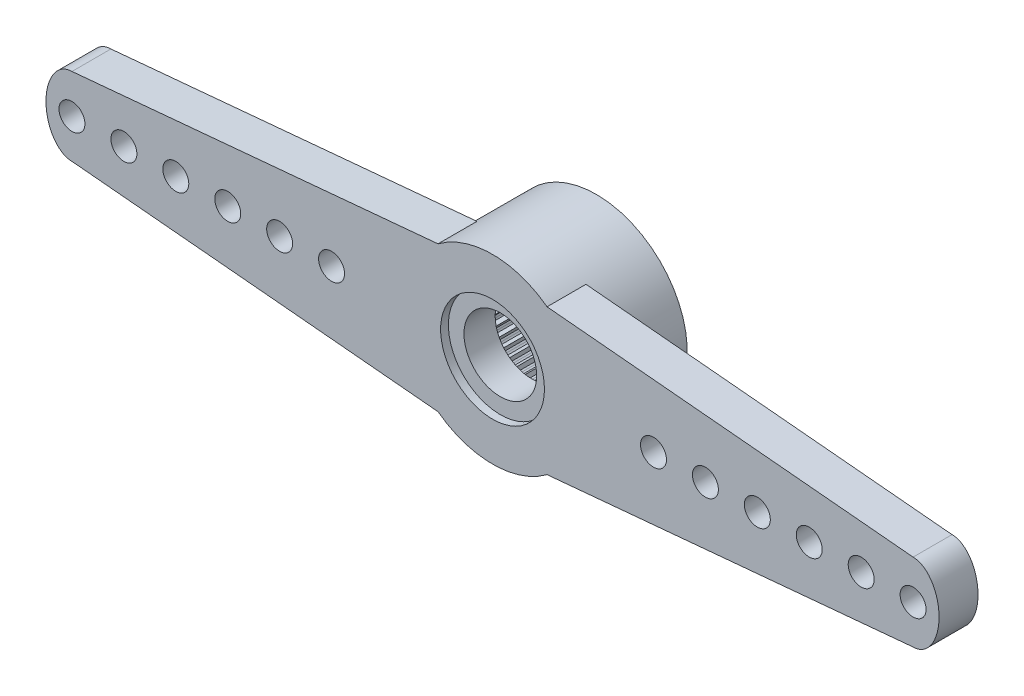
from build123d import *
from build123d.topology import SkipClean

# Parameters (mm, degrees)
CROQUIS1_R              = 0.5
SALIENTE_EXTRUIR1_DEPTH = 1.5
SALIENTE_EXTRUIR2_START = 2.5
CROQUIS3_R              = 3.5
CROQUIS3_R_2            = 2.25
SALIENTE_EXTRUIR2_DEPTH = 2.5
CROQUIS4_R              = 1.4
CORTAR_EXTRUIR1_DEPTH   = 18.729636323
CROQUIS5_R              = 2
CORTAR_EXTRUIR2_DEPTH   = 0.3
CORTAR_EXTRUIR4_DEPTH   = 2


with BuildPart() as part:
    # Croquis1 → Saliente-Extruir1 (new body)
    with BuildSketch(Plane.XY):
        with BuildLine():
            Line((-2.1, 2.8), (-16.2, 1.5))
            add(Edge.make_bspline(
                [(-16.2, 1.5), (-17.2, 1.5), (-17.2, 0), (-17.2, -1.5), (-16.2, -1.5)],
                knots=[3.141592654, 3.141592654, 3.141592654, 4.71238898, 4.71238898, 6.283185307, 6.283185307, 6.283185307], degree=2, weights=[1, 0.707106781, 1, 0.707106781, 1]))
            Line((-16.2, -1.5), (-2.1, -2.8))
            ThreePointArc((-2.1, -2.8), (0, -3.5), (2.1, -2.8))
            Line((2.1, -2.8), (16.2, -1.5))
            add(Edge.make_bspline(
                [(16.2, -1.5), (17.2, -1.5), (17.2, 0), (17.2, 1.5), (16.2, 1.5)],
                knots=[0, 0, 0, 1.570796327, 1.570796327, 3.141592654, 3.141592654, 3.141592654], degree=2, weights=[1, 0.707106781, 1, 0.707106781, 1]))
            Line((16.2, 1.5), (2.1, 2.8))
            ThreePointArc((2.1, 2.8), (0, 3.5), (-2.1, 2.8))
        make_face()
        with Locations((-16.2, 0)):
            Circle(CROQUIS1_R, mode=Mode.SUBTRACT)
        with Locations((-14.2, 0)):
            Circle(CROQUIS1_R, mode=Mode.SUBTRACT)
        with Locations((-12.2, 0)):
            Circle(CROQUIS1_R, mode=Mode.SUBTRACT)
        with Locations((-10.2, 0)):
            Circle(CROQUIS1_R, mode=Mode.SUBTRACT)
        with Locations((-8.2, 0)):
            Circle(CROQUIS1_R, mode=Mode.SUBTRACT)
        with Locations((-6.2, 0)):
            Circle(CROQUIS1_R, mode=Mode.SUBTRACT)
        with Locations(Location((6.2, 0, 0), (0, 0, 180))):
            Circle(CROQUIS1_R, mode=Mode.SUBTRACT)
        with Locations(Location((8.2, 0, 0), (0, 0, 180))):
            Circle(CROQUIS1_R, mode=Mode.SUBTRACT)
        with Locations(Location((10.2, 0, 0), (0, 0, 180))):
            Circle(CROQUIS1_R, mode=Mode.SUBTRACT)
        with Locations(Location((12.2, 0, 0), (0, 0, 180))):
            Circle(CROQUIS1_R, mode=Mode.SUBTRACT)
        with Locations(Location((14.2, 0, 0), (0, 0, 180))):
            Circle(CROQUIS1_R, mode=Mode.SUBTRACT)
        with Locations(Location((16.2, 0, 0), (0, 0, 180))):
            Circle(CROQUIS1_R, mode=Mode.SUBTRACT)
    extrude(amount=SALIENTE_EXTRUIR1_DEPTH)

    # Croquis3 → Saliente-Extruir2 (add)
    with SkipClean():  # the faces are left unmerged after this step: merging them gives an invalid solid
        with BuildSketch(Plane(origin=(0, 0, 0), x_dir=(-1, 0, 0), z_dir=(0, 0, -1)).offset(SALIENTE_EXTRUIR2_START)):
            Circle(CROQUIS3_R)
            Circle(CROQUIS3_R_2, mode=Mode.SUBTRACT)
        extrude(amount=-SALIENTE_EXTRUIR2_DEPTH)

    # Croquis4 → Cortar-Extruir1 (cut, through all)
    with SkipClean():  # the faces are left unmerged after this step: merging them gives an invalid solid
        with BuildSketch(Plane(origin=(0, 0, 0), x_dir=(-1, 0, 0), z_dir=(0, 0, -1))):
            Circle(CROQUIS4_R)
        extrude(amount=-CORTAR_EXTRUIR1_DEPTH, mode=Mode.SUBTRACT)

    # Croquis5 → Cortar-Extruir2 (cut)
    with SkipClean():  # the faces are left unmerged after this step: merging them gives an invalid solid
        with BuildSketch(Plane.XY.offset(1.5)):
            Circle(CROQUIS5_R)
        extrude(amount=-CORTAR_EXTRUIR2_DEPTH, mode=Mode.SUBTRACT)

    # Croquis6 → Cortar-Extruir4 (cut)
    with SkipClean():  # the faces are left unmerged after this step: merging them gives an invalid solid
        with BuildSketch(Plane(origin=(0, 0, -2.5), x_dir=(-1, 0, 0), z_dir=(0, 0, -1))):
            Polygon((0, -2.25), (0.10043817, -2.397897449), (0.167368384, -2.394157017), (0.234167805, -2.388546162), (0.31304517, -2.228109749), (0.433089229, -2.360589579), (0.498847515, -2.347570664), (0.564215969, -2.33271773), (0.619997273, -2.162865066), (0.757310699, -2.277348707), (0.820617148, -2.255304706), (0.883282311, -2.23149879), (0.914881833, -2.055535863), (1.066791978, -2.149795022), (1.126414401, -2.119154997), (1.185156568, -2.086859453), (1.191959259, -1.908211182), (1.355509365, -1.980411211), (1.410287279, -1.941771536), (1.4639631, -1.90161496), (1.445836554, -1.723758531), (1.617843304, -1.772494138), (1.666710519, -1.72660689), (1.714275256, -1.679370884), (1.671572286, -1.505768069), (1.848687763, -1.530090672), (1.890693135, -1.477848993), (1.931220994, -1.424452954), (1.864772764, -1.258482734), (2.043549617, -1.257918921), (2.07787556, -1.200339636), (2.110577712, -1.141822856), (2.021677561, -0.986715653), (2.198636103, -0.961276398), (2.2246145, -0.899480223), (2.248854435, -0.836981664), (2.139232704, -0.695756463), (2.310928638, -0.645936912), (2.32805385, -0.581126639), (2.343359765, -0.515862765), (2.215150116, -0.391268354), (2.378241576, -0.318038189), (2.38618028, -0.251475276), (2.392254263, -0.184716373), (2.247952151, -0.079177841), (2.399264746, 0.016037597), (2.397862424, 0.083057578), (2.394586253, 0.150012123), (2.237000354, 0.234440589), (2.373588958, 0.349788041), (2.362872904, 0.415960623), (2.350310345, 0.481807615), (2.18250789, 0.543482711), (2.30171396, 0.676717069), (2.281892751, 0.740754277), (2.260288319, 0.804212081), (2.085535392, 0.841933371), (2.185038718, 0.990461379), (2.156498151, 1.051116803), (2.126272353, 1.110950284), (1.94797032, 1.123983566), (2.025834183, 1.284914297), (1.989129768, 1.341007347), (1.950870913, 1.396051915), (1.772490222, 1.384143511), (1.82719909, 1.55434463), (1.783045236, 1.604783519), (1.737497991, 1.653967793), (1.562510617, 1.617349487), (1.592999645, 1.793508224), (1.542255757, 1.837311216), (1.490306646, 1.879677881), (1.322118521, 1.819062407), (1.327794274, 1.997750031), (1.271448023, 2.034064551), (1.214108178, 2.068788988), (1.055992892, 1.985356156), (1.036744898, 2.163094717), (0.975893001, 2.191213944), (0.914278475, 2.217620281), (0.769313562, 2.112994017), (0.725516462, 2.286324036), (0.661343331, 2.305700661), (0.596653382, 2.323274929), (0.467660419, 2.199491664), (0.400166673, 2.365039469), (0.333921365, 2.375296349), (0.267415109, 2.383696484), (0.156904797, 2.243165519), (0.067028095, 2.397708909), (0, 2.398646405), (-0.067028095, 2.397708909), (-0.156904797, 2.243165519), (-0.267415109, 2.383696484), (-0.333921365, 2.375296349), (-0.400166673, 2.365039469), (-0.467660419, 2.199491664), (-0.596653382, 2.323274929), (-0.661343331, 2.305700661), (-0.725516462, 2.286324036), (-0.769313562, 2.112994017), (-0.914278475, 2.217620281), (-0.975893001, 2.191213944), (-1.036744898, 2.163094717), (-1.055992892, 1.985356156), (-1.214108178, 2.068788988), (-1.271448023, 2.034064551), (-1.327794274, 1.997750031), (-1.322118521, 1.819062407), (-1.490306646, 1.879677881), (-1.542255757, 1.837311216), (-1.592999645, 1.793508224), (-1.562510617, 1.617349487), (-1.737497991, 1.653967793), (-1.783045236, 1.604783519), (-1.82719909, 1.55434463), (-1.772490222, 1.384143511), (-1.950870913, 1.396051915), (-1.989129768, 1.341007347), (-2.025834183, 1.284914297), (-1.94797032, 1.123983566), (-2.126272353, 1.110950284), (-2.156498151, 1.051116803), (-2.185038718, 0.990461379), (-2.085535392, 0.841933371), (-2.260288319, 0.804212081), (-2.281892751, 0.740754277), (-2.30171396, 0.676717069), (-2.18250789, 0.543482711), (-2.350310345, 0.481807615), (-2.362872904, 0.415960623), (-2.373588958, 0.349788041), (-2.237000354, 0.234440589), (-2.394586253, 0.150012123), (-2.397862424, 0.083057578), (-2.399264746, 0.016037597), (-2.247952151, -0.079177841), (-2.392254263, -0.184716373), (-2.38618028, -0.251475276), (-2.378241576, -0.318038189), (-2.215150116, -0.391268354), (-2.343359765, -0.515862765), (-2.32805385, -0.581126639), (-2.310928638, -0.645936912), (-2.139232704, -0.695756463), (-2.248854435, -0.836981664), (-2.2246145, -0.899480223), (-2.198636103, -0.961276398), (-2.021677561, -0.986715653), (-2.110577712, -1.141822856), (-2.07787556, -1.200339636), (-2.043549617, -1.257918921), (-1.864772764, -1.258482734), (-1.931220994, -1.424452954), (-1.890693135, -1.477848993), (-1.848687763, -1.530090672), (-1.671572286, -1.505768069), (-1.714275256, -1.679370884), (-1.666710519, -1.72660689), (-1.617843304, -1.772494138), (-1.445836554, -1.723758531), (-1.4639631, -1.90161496), (-1.410287279, -1.941771536), (-1.355509365, -1.980411211), (-1.191959259, -1.908211182), (-1.185156568, -2.086859453), (-1.126414401, -2.119154997), (-1.066791978, -2.149795022), (-0.914881833, -2.055535863), (-0.883282311, -2.23149879), (-0.820617148, -2.255304706), (-0.757310699, -2.277348707), (-0.619997273, -2.162865066), (-0.564215969, -2.33271773), (-0.498847515, -2.347570664), (-0.433089229, -2.360589579), (-0.31304517, -2.228109749), (-0.234167805, -2.388546162), (-0.167368384, -2.394157017), (-0.10043817, -2.397897449), align=None)
        extrude(amount=-CORTAR_EXTRUIR4_DEPTH, mode=Mode.SUBTRACT)


solid = part.part
